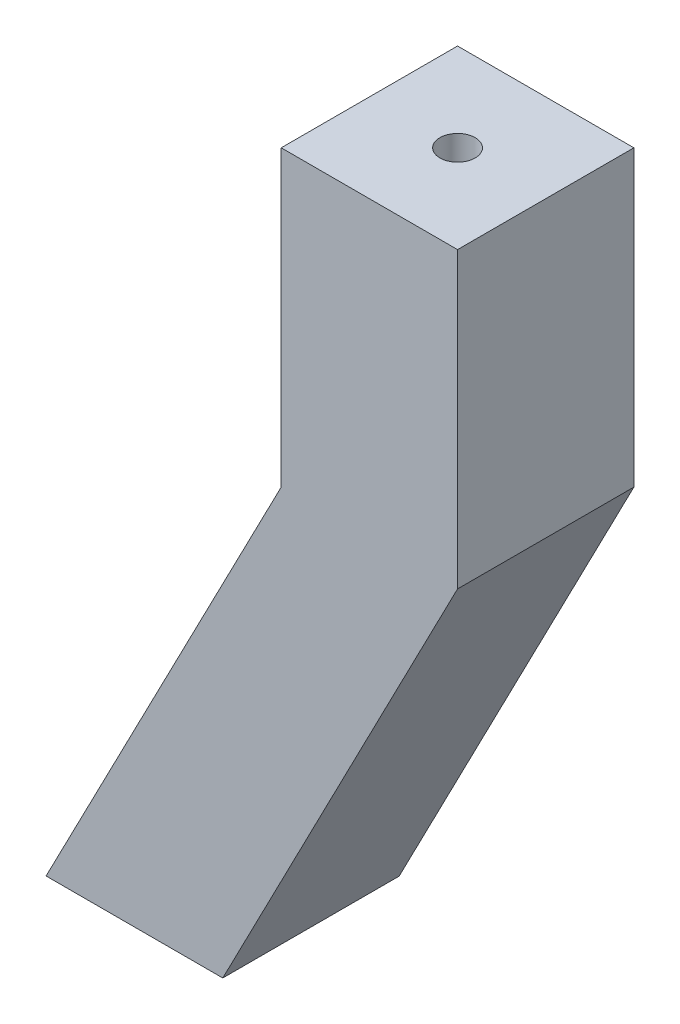
from build123d import *

# Parameters (mm, degrees)
SKETCH_1_W          = 30
SKETCH_1_H          = 30
EXTRUDE_1_DEPTH     = 50
SKETCH_3_W          = 30
SKETCH_3_H          = 87.301509621
EXTRUDE_2_DEPTH     = 40
SKETCH_4_W          = 30
SKETCH_4_H          = 77.301509621
EXTRUDE_3_DEPTH     = 30
SKETCH_7_W          = 40
SKETCH_7_H          = 10
CUT_EXTRUDE_1_DEPTH = 30
CUT_EXTRUDE_2_DEPTH = 30
CUT_EXTRUDE_5_DEPTH = 30
SKETCH_21_R         = 3
CUT_EXTRUDE_6_DEPTH = 50


with BuildPart() as part:
    # 草图1 → 凸台-拉伸1 (new body)
    with BuildSketch(Plane(origin=(0, 0, 0), x_dir=(1, 0, 0), z_dir=(0, 1, 0))):
        Rectangle(SKETCH_1_W, SKETCH_1_H)
    extrude(amount=EXTRUDE_1_DEPTH)

    # 草图3 → 凸台-拉伸2 (add)
    with BuildSketch(Plane.ZY.offset(15)):
        with Locations((0, -33.650754811)):
            Rectangle(SKETCH_3_W, SKETCH_3_H)
    extrude(amount=EXTRUDE_2_DEPTH)

    # 草图4 → 凸台-拉伸3 (add)
    with BuildSketch(Plane(origin=(-15, 0, 0), x_dir=(0, 0, -1), z_dir=(1, 0, 0))):
        with Locations((0, -38.650754811)):
            Rectangle(SKETCH_4_W, SKETCH_4_H)
    extrude(amount=EXTRUDE_3_DEPTH)

    # 草图7 → 切除-拉伸1 (cut)
    with BuildSketch(Plane.XY.offset(15)):
        with Locations((-35, 5)):
            Rectangle(SKETCH_7_W, SKETCH_7_H)
    extrude(amount=-CUT_EXTRUDE_1_DEPTH, mode=Mode.SUBTRACT)

    # 草图8 → 切除-拉伸2 (cut)
    with BuildSketch(Plane.XY.offset(15)):
        Polygon((-15, 0), (-55, 0), (-95.241358959, -77.747534748), (-55.241358959, -77.747534748), align=None)
    extrude(amount=-CUT_EXTRUDE_2_DEPTH, mode=Mode.SUBTRACT)

    # 草图9 → 切除-拉伸5 (cut)
    with BuildSketch(Plane.XY.offset(15)):
        Polygon((15, 0), (-26.125228954, -79.582689845), (25.626144769, -79.582689845), (66.751373723, 0), align=None)
    extrude(amount=-CUT_EXTRUDE_5_DEPTH, mode=Mode.SUBTRACT)

    # 草图21 → 切除-拉伸6 (cut)
    with BuildSketch(Plane(origin=(0, 50, 0), x_dir=(1, 0, 0), z_dir=(0, 1, 0))):
        with Locations(Location((0, 0, 0), (0, 0, 270))):
            Circle(SKETCH_21_R)
    extrude(amount=-CUT_EXTRUDE_6_DEPTH, mode=Mode.SUBTRACT)


solid = part.part
